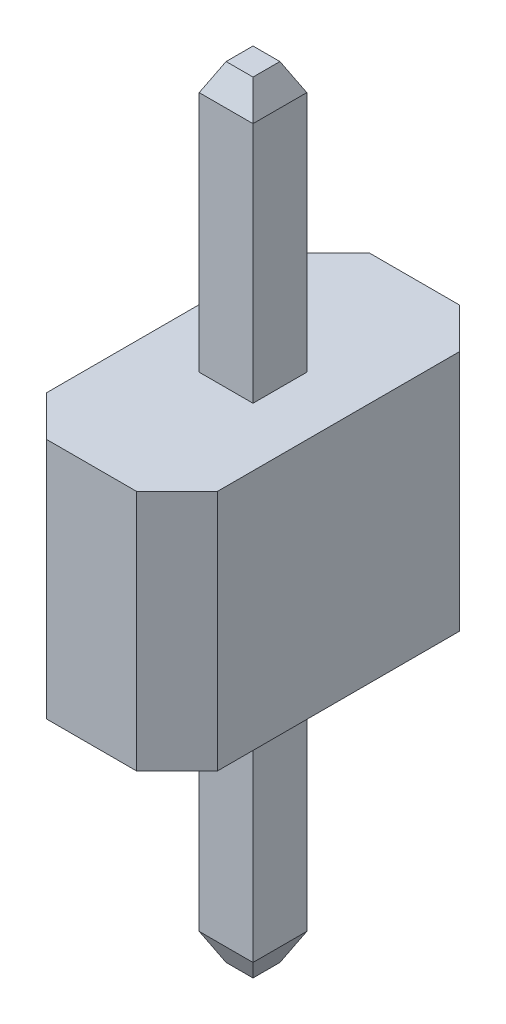
from build123d import *
from OCP.BRepFilletAPI import BRepFilletAPI_MakeChamfer

# Parameters (mm, degrees)
SKETCH_1_W           = 1.27
SKETCH_1_H           = 2.4
EXTRUDE_1_DEPTH      = 1.8
EXTRUDE_2_DEPTH      = 2
EXTRUDE_2_DEPTH_BACK = 3.8
SKETCH_2_W           = 0.4
SKETCH_2_H           = 0.4
CUT_EXTRUDE_1_DEPTH  = 5.035247824
CHAMFER_1_SIZE       = 0.2
CHAMFER_1_SIZE2      = 0.1
CHAMFER_2_SIZE       = 0.1
CHAMFER_2_SIZE2      = 0.2


with BuildPart() as part:
    # 草图1 → 凸台-拉伸1 (new body)
    with BuildSketch(Plane(origin=(0, 0, 0), x_dir=(1, 0, 0), z_dir=(0, 1, 0))):
        Rectangle(SKETCH_1_W, SKETCH_1_H)
    extrude(amount=EXTRUDE_1_DEPTH)

    # 草图2 → 凸台-拉伸2 (add, two sides: drawn at the far end of the back side and taken through both)
    with BuildSketch(Plane(origin=(0, 1.8, 0), x_dir=(1, 0, 0), z_dir=(0, 1, 0)).offset(-EXTRUDE_2_DEPTH_BACK)):
        Rectangle(SKETCH_2_W, SKETCH_2_H)
    extrude(amount=EXTRUDE_2_DEPTH + EXTRUDE_2_DEPTH_BACK)

    # 草图3 → 切除-拉伸1 (cut, through all)
    with BuildSketch(Plane(origin=(0, 1.8, 0), x_dir=(1, 0, 0), z_dir=(0, 1, 0))):
        Polygon((-0.335, 1.2), (-0.635, 0.9), (-0.635, 1.2), align=None)
        Polygon((0.635, 1.2), (0.335, 1.2), (0.635, 0.9), align=None)
        Polygon((0.335, -1.2), (0.635, -0.9), (0.635, -1.2), align=None)
        Polygon((-0.635, -1.2), (-0.335, -1.2), (-0.635, -0.9), align=None)
    extrude(amount=-CUT_EXTRUDE_1_DEPTH, mode=Mode.SUBTRACT)

    # 倒角1: one chamfer whose edges measure the first distance from different faces: ONE call of the kernel's chamfer builder (chamfer() names one face for all edges)
    chamfer_1_edges_1 = [part.edges().sort_by_distance(p)[0] for p in [
        (0.2, 3.8, 0),
    ]]
    chamfer_1_side_1 = [part.faces().sort_by_distance(p)[0] for p in [
        (0.2, 2.8, 0),
    ]]
    chamfer_1_edges_2 = [part.edges().sort_by_distance(p)[0] for p in [
        (0, 3.8, -0.2),
    ]]
    chamfer_1_side_2 = [part.faces().sort_by_distance(p)[0] for p in [
        (0, 2.8, -0.2),
    ]]
    chamfer_1_edges_3 = [part.edges().sort_by_distance(p)[0] for p in [
        (-0.2, 3.8, 0),
    ]]
    chamfer_1_side_3 = [part.faces().sort_by_distance(p)[0] for p in [
        (-0.2, 2.8, 0),
    ]]
    chamfer_1_edges_4 = [part.edges().sort_by_distance(p)[0] for p in [
        (0, 3.8, 0.2),
    ]]
    chamfer_1_side_4 = [part.faces().sort_by_distance(p)[0] for p in [
        (0, 2.8, 0.2),
    ]]
    chamfer_1 = BRepFilletAPI_MakeChamfer(part.part.solid().wrapped)
    for e in chamfer_1_edges_1:
        chamfer_1.Add(CHAMFER_1_SIZE, CHAMFER_1_SIZE2, e.wrapped, chamfer_1_side_1[0].wrapped)  # the first distance lies on this face
    for e in chamfer_1_edges_2:
        chamfer_1.Add(CHAMFER_1_SIZE, CHAMFER_1_SIZE2, e.wrapped, chamfer_1_side_2[0].wrapped)  # the first distance lies on this face
    for e in chamfer_1_edges_3:
        chamfer_1.Add(CHAMFER_1_SIZE, CHAMFER_1_SIZE2, e.wrapped, chamfer_1_side_3[0].wrapped)  # the first distance lies on this face
    for e in chamfer_1_edges_4:
        chamfer_1.Add(CHAMFER_1_SIZE, CHAMFER_1_SIZE2, e.wrapped, chamfer_1_side_4[0].wrapped)  # the first distance lies on this face
    add(Compound.cast(chamfer_1.Shape()), mode=Mode.REPLACE)

    # 倒角2
    chamfer_2_edges = [part.edges().sort_by_distance(p)[0] for p in [
        (0.2, -2, 0),
        (0, -2, 0.2),
        (-0.2, -2, 0),
        (0, -2, -0.2),
    ]]
    chamfer_2_side = [part.faces().sort_by_distance(p)[0] for p in [
        (0, -2, 0),
    ]]
    chamfer(chamfer_2_edges, length=CHAMFER_2_SIZE, length2=CHAMFER_2_SIZE2, reference=chamfer_2_side[0])


solid = part.part
